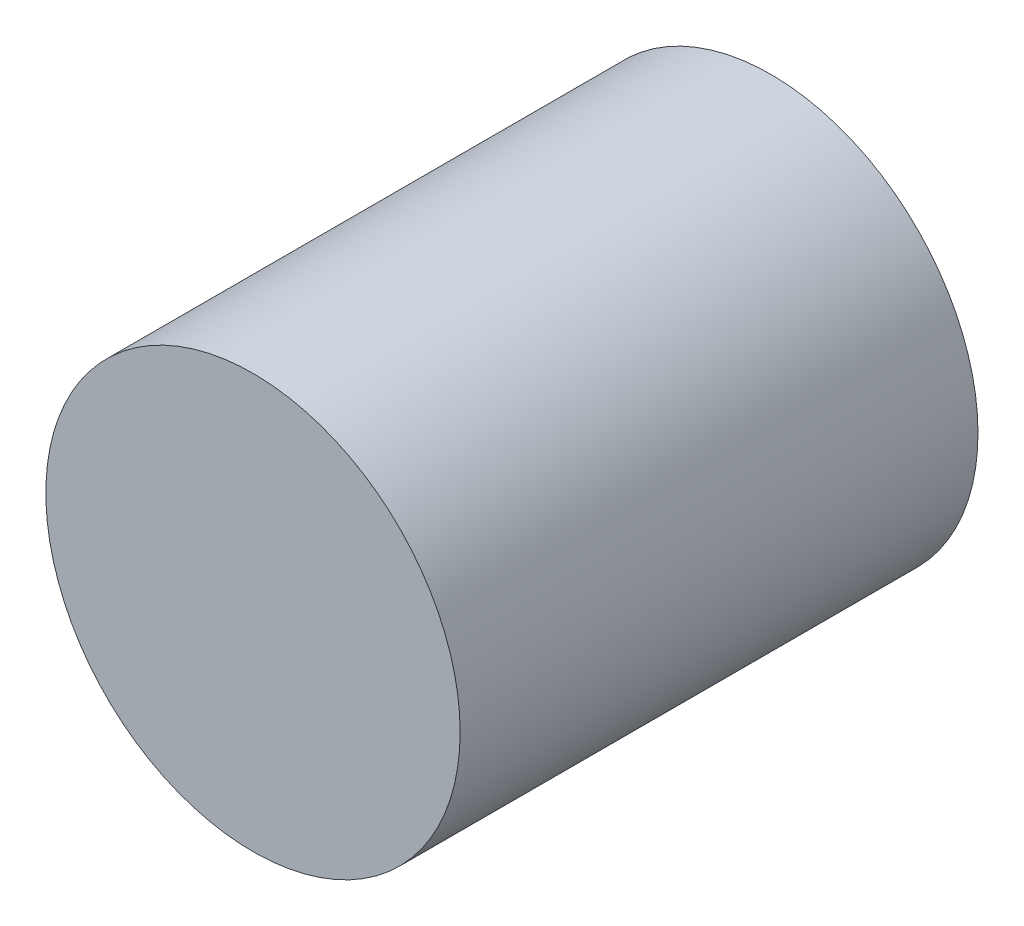
from build123d import *

# Parameters (mm, degrees)
SKETCH_1_R      = 2
EXTRUDE_1_DEPTH = 5


with BuildPart() as part:
    # Эскиз1 → Бобышка-Вытянуть1 (new body)
    with BuildSketch(Plane.XY):
        Circle(SKETCH_1_R)
    extrude(amount=EXTRUDE_1_DEPTH)


solid = part.part
